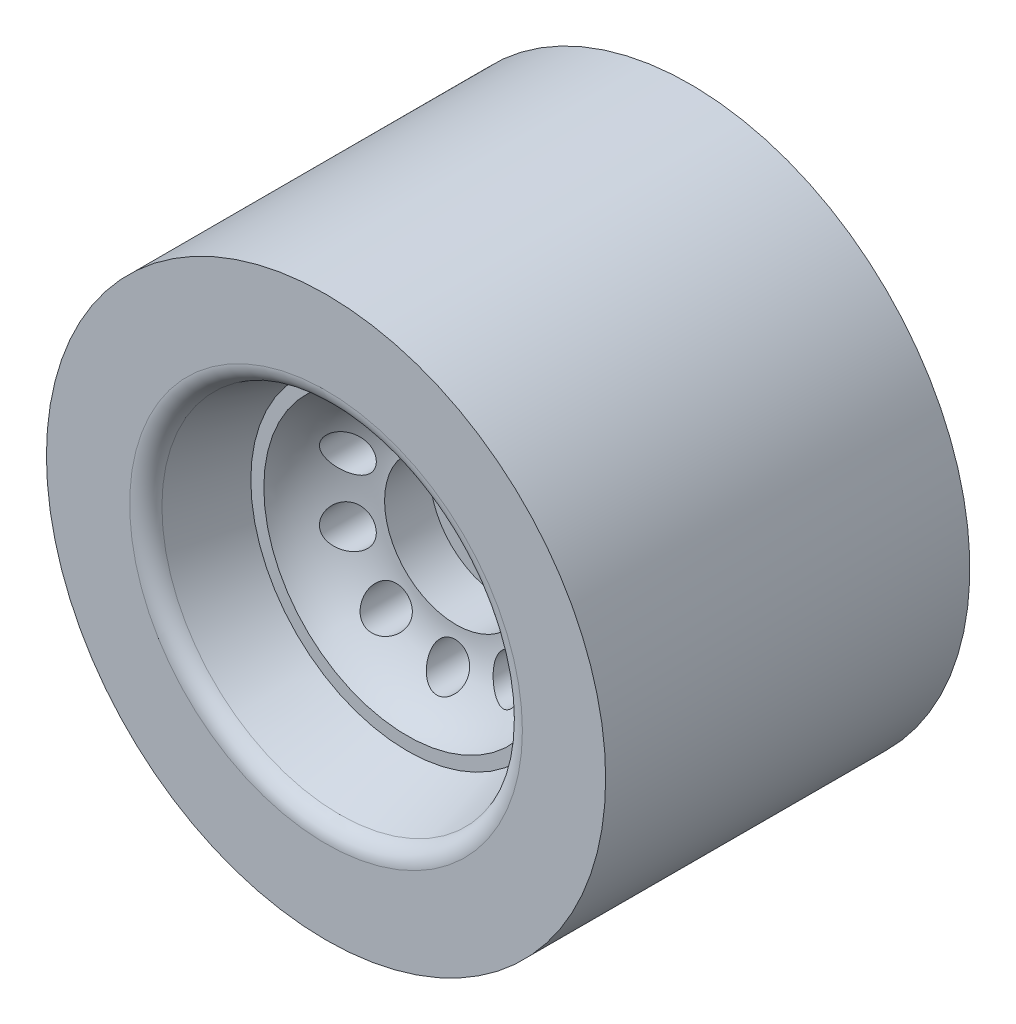
from build123d import *

# Parameters (mm, degrees)
SKETCH_1_R               = 43
EXTRUDE_1_DEPTH          = 28
SKETCH_2_R               = 5
CUT_EXTRUDE_1_DEPTH      = 83.668010742
SKETCH_5_R               = 3
CUT_EXTRUDE_2_DEPTH      = 67.947740813
PATTERN_CIRCULAR_1_COUNT = 10
FILLET_1_R               = 3
SKETCH_6_R               = 11
CUT_EXTRUDE_3_DEPTH      = 7
CUT_EXTRUDE_START        = -7
SKETCH_7_R               = 11
CUT_EXTRUDE_4_DEPTH      = 7


with BuildPart() as part:
    # 스케치1 → 보스-돌출1 (new, symmetric)
    with BuildSketch(Plane.XY):
        Circle(SKETCH_1_R)
    extrude(amount=EXTRUDE_1_DEPTH, both=True)

    # 스케치2 → 컷-돌출1 (cut, through all)
    with BuildSketch(Plane.XY.offset(28)):
        Circle(SKETCH_2_R)
    extrude(amount=-CUT_EXTRUDE_1_DEPTH, mode=Mode.SUBTRACT)

    # 스케치4 → 컷-회전1 (revolve, cut)
    with BuildSketch(Plane(origin=(0, 0, 0), x_dir=(0, 0, -1), z_dir=(1, 0, 0)), mode=Mode.PRIVATE) as cut_revolve_1_sk:
        with BuildLine():
            Line((28, 43), (27.2, 36.9))
            Line((27.2, 36.9), (26.2, 36.4))
            ThreePointArc((26.2, 36.4), (25.625171533, 32.144062045), (24.234467809, 28.080888557))
            ThreePointArc((24.234467809, 28.080888557), (23.147731653, 25.134572205), (22.5083716, 22.06))
            ThreePointArc((22.5083716, 22.06), (17.054433029, 17.683921829), (15, 11))
            Line((15, 11), (15, 0))
            Line((15, 0), (28, 0))
            Line((28, 0), (28, 43))
        make_face()
        with BuildLine():
            Line((-28, 0), (-28, 28))
            Line((-28, 28), (-15.5083716, 24.06))
            Line((-15.5083716, 24.06), (-15.5083716, 22.06))
            ThreePointArc((-15.5083716, 22.06), (-10.054433029, 17.683921829), (-8, 11))
            Line((-8, 11), (-8, 0))
            Line((-8, 0), (-28, 0))
        make_face()
    revolve(cut_revolve_1_sk.sketch.rotate(Axis((0, 0, -28), (0, 0, 1)), 90), axis=Axis((0, 0, -28), (0, 0, 1)), mode=Mode.SUBTRACT)

    # 스케치5 → 컷-돌출2 (cut, symmetric)
    with BuildSketch(Plane.XY):
        with Locations(Location((0, 15.875, 0), (0, 0, 222.496466029))):
            Circle(SKETCH_5_R)
    cut_extrude_2 = extrude(amount=CUT_EXTRUDE_2_DEPTH, both=True, mode=Mode.SUBTRACT)

    # 원형 패턴1: 컷-돌출2 ×10 about axis
    pattern_circular_1_axis = Axis((0, 0, 0), (0, 0, 1))
    for i in range(1, PATTERN_CIRCULAR_1_COUNT):
        add(cut_extrude_2.rotate(pattern_circular_1_axis, i * 360 / PATTERN_CIRCULAR_1_COUNT), mode=Mode.SUBTRACT)

    # 필렛1
    fillet_1_edges = [part.edges().sort_by_distance(p)[0] for p in [
        (28, 0, 28),
    ]]
    fillet(fillet_1_edges, radius=FILLET_1_R)

    # 스케치6 → 컷-돌출3 (cut)
    with BuildSketch(Plane.XY.offset(8)):
        Circle(SKETCH_6_R)
    extrude(amount=-CUT_EXTRUDE_3_DEPTH, mode=Mode.SUBTRACT)

    # 스케치7 → 컷-돌출4 (cut)
    with BuildSketch(Plane(origin=(0, 0, -15), x_dir=(-1, 0, 0), z_dir=(0, 0, -1)).offset(CUT_EXTRUDE_START)):
        with Locations(Location((0, 0, 0), (0, 0, 180))):
            Circle(SKETCH_7_R)
    extrude(amount=CUT_EXTRUDE_4_DEPTH, mode=Mode.SUBTRACT)


solid = part.part
